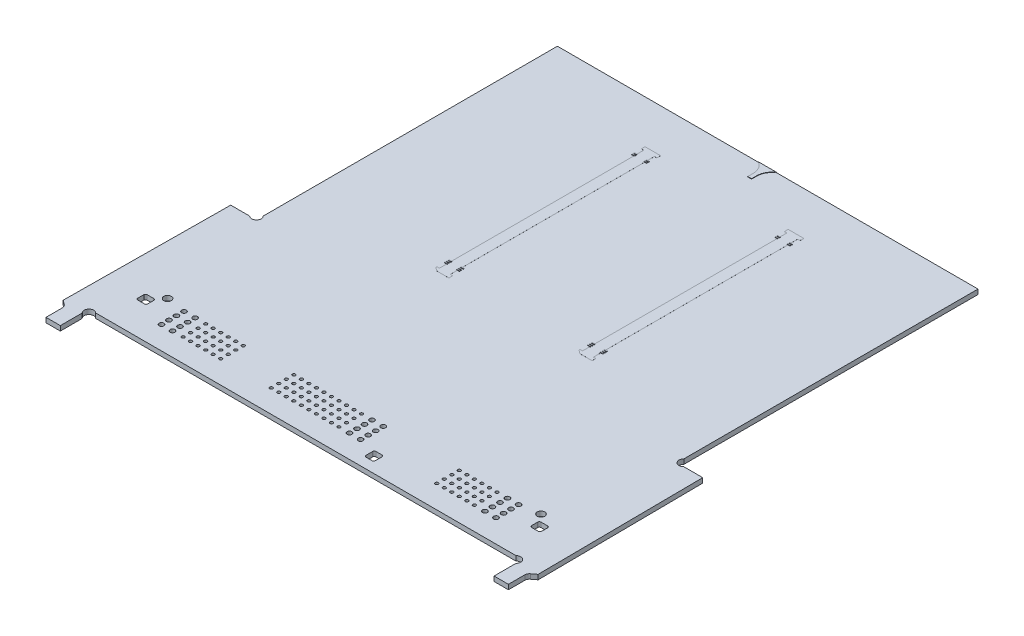
from build123d import *

# Parameters (mm, degrees)
SKETCH4_R      = 1.254
SKETCH4_R_2    = 0.79375
SKETCH4_R_3    = 0.508
SKETCH4_R_4    = 0.3762
SKETCH4_R_5    = 0.4762
EXTRUDE3_DEPTH = 0.79375
EXTRUDE5_DEPTH = 0.0127
SKETCH5_W      = 0.92
SKETCH5_H      = 0.27
EXTRUDE4_DEPTH = 0.127


with BuildPart() as part:
    # Sketch4 → Extrude3 (new, symmetric)
    with BuildSketch(Plane(origin=(0, 0, 0), x_dir=(1, 0, 0), z_dir=(0, 1, 0))):
        with BuildLine():
            Line((69.8881, 132.04590549), (2.975548534, 132.04590549))
            Line((2.975548534, 132.04590549), (-2.975548534, 132.04590549))
            Line((-2.975548534, 132.04590549), (-69.8881, 132.04590549))
            Line((-69.8881, 132.04590549), (-69.8881, 34.269186558))
            ThreePointArc((-69.8881, 34.269186558), (-69.8881, 32.024122527), (-72.13316403, 32.024122527))
            Line((-72.13316403, 32.024122527), (-78.429293154, 32.024122527))
            Line((-78.429293154, 32.024122527), (-78.910794169, -23.152529514))
            Line((-78.910794169, -23.152529514), (-77.458445681, -24.262651291))
            ThreePointArc((-77.458445681, -24.262651291), (-76.999370968, -24.82043999), (-76.835, -25.52390286))
            Line((-76.835, -25.52390286), (-76.835, -30.960744262))
            Line((-76.835, -30.960744262), (-72.070498153, -30.960744262))
            Line((-72.070498153, -30.960744262), (-72.070498153, -23.691557319))
            ThreePointArc((-72.070498153, -23.691557319), (-72.070498153, -21.446493288), (-69.825434123, -21.446493288))
            Line((-69.825434123, -21.446493288), (69.825434123, -21.446493288))
            ThreePointArc((69.825434123, -21.446493288), (72.070498153, -21.446493288), (72.070498153, -23.691557319))
            Line((72.070498153, -23.691557319), (72.070498153, -30.960744262))
            Line((72.070498153, -30.960744262), (76.835, -30.960744262))
            Line((76.835, -30.960744262), (76.835, -25.52390286))
            ThreePointArc((76.835, -25.52390286), (76.999370968, -24.82043999), (77.458445681, -24.262651291))
            Line((77.458445681, -24.262651291), (78.910794169, -23.152529514))
            Line((78.910794169, -23.152529514), (78.429293154, 32.024122527))
            Line((78.429293154, 32.024122527), (72.13316403, 32.024122527))
            ThreePointArc((72.13316403, 32.024122527), (69.8881, 32.024122527), (69.8881, 34.269186558))
            Line((69.8881, 34.269186558), (69.8881, 132.04590549))
        make_face()
        with Locations((62.05, -5.34148242)):
            Circle(SKETCH4_R, mode=Mode.SUBTRACT)
        with Locations((-62.05, -5.34148242)):
            Circle(SKETCH4_R, mode=Mode.SUBTRACT)
        with Locations((51.9, -6.33898242)):
            Circle(SKETCH4_R_2, mode=Mode.SUBTRACT)
        with Locations((3.4, -6.33898242)):
            Circle(SKETCH4_R_3, mode=Mode.SUBTRACT)
        with Locations((6.9, -6.33898242)):
            Circle(SKETCH4_R_2, mode=Mode.SUBTRACT)
        with Locations((55.6, -6.33898242)):
            Circle(SKETCH4_R_2, mode=Mode.SUBTRACT)
        with Locations((10.6, -6.33898242)):
            Circle(SKETCH4_R_2, mode=Mode.SUBTRACT)
        with Locations((-55.6, -6.33898242)):
            Circle(SKETCH4_R_2, mode=Mode.SUBTRACT)
        with Locations((-48.4, -6.33898242)):
            Circle(SKETCH4_R_3, mode=Mode.SUBTRACT)
        with Locations((-55.6, -11.33898242)):
            Circle(SKETCH4_R_2, mode=Mode.SUBTRACT)
        with Locations((-51.9, -8.83898242)):
            Circle(SKETCH4_R_2, mode=Mode.SUBTRACT)
        with Locations((-55.6, -8.83898242)):
            Circle(SKETCH4_R_2, mode=Mode.SUBTRACT)
        with Locations((-51.9, -6.33898242)):
            Circle(SKETCH4_R_2, mode=Mode.SUBTRACT)
        with Locations((51.9, -8.83898242)):
            Circle(SKETCH4_R_2, mode=Mode.SUBTRACT)
        with Locations((6.9, -8.83898242)):
            Circle(SKETCH4_R_2, mode=Mode.SUBTRACT)
        with Locations((55.6, -8.83898242)):
            Circle(SKETCH4_R_2, mode=Mode.SUBTRACT)
        with Locations((10.6, -8.83898242)):
            Circle(SKETCH4_R_2, mode=Mode.SUBTRACT)
        with Locations((10.6, -13.83898242)):
            Circle(SKETCH4_R_2, mode=Mode.SUBTRACT)
        with Locations((51.9, -11.33898242)):
            Circle(SKETCH4_R_2, mode=Mode.SUBTRACT)
        with Locations((6.9, -11.33898242)):
            Circle(SKETCH4_R_2, mode=Mode.SUBTRACT)
        with Locations((55.6, -11.33898242)):
            Circle(SKETCH4_R_2, mode=Mode.SUBTRACT)
        with Locations((10.6, -11.33898242)):
            Circle(SKETCH4_R_2, mode=Mode.SUBTRACT)
        with Locations((-51.9, -13.83898242)):
            Circle(SKETCH4_R_2, mode=Mode.SUBTRACT)
        with Locations((-55.6, -13.83898242)):
            Circle(SKETCH4_R_2, mode=Mode.SUBTRACT)
        with Locations((-51.9, -11.33898242)):
            Circle(SKETCH4_R_2, mode=Mode.SUBTRACT)
        with Locations((-35.9, -6.33898242)):
            Circle(SKETCH4_R_3, mode=Mode.SUBTRACT)
        with Locations((-38.4, -6.33898242)):
            Circle(SKETCH4_R_3, mode=Mode.SUBTRACT)
        with Locations((-40.9, -6.33898242)):
            Circle(SKETCH4_R_3, mode=Mode.SUBTRACT)
        with Locations((-43.4, -6.33898242)):
            Circle(SKETCH4_R_3, mode=Mode.SUBTRACT)
        with Locations((-45.9, -6.33898242)):
            Circle(SKETCH4_R_3, mode=Mode.SUBTRACT)
        with Locations((6.9, -13.83898242)):
            Circle(SKETCH4_R_2, mode=Mode.SUBTRACT)
        with Locations((48.4, -6.33898242)):
            Circle(SKETCH4_R_3, mode=Mode.SUBTRACT)
        with Locations((55.6, -13.83898242)):
            Circle(SKETCH4_R_2, mode=Mode.SUBTRACT)
        with Locations((-45.9, -11.33898242)):
            Circle(SKETCH4_R_3, mode=Mode.SUBTRACT)
        with Locations((-48.4, -11.33898242)):
            Circle(SKETCH4_R_3, mode=Mode.SUBTRACT)
        with Locations((-35.9, -8.83898242)):
            Circle(SKETCH4_R_3, mode=Mode.SUBTRACT)
        with Locations((-38.4, -8.83898242)):
            Circle(SKETCH4_R_3, mode=Mode.SUBTRACT)
        with Locations((-40.9, -8.83898242)):
            Circle(SKETCH4_R_3, mode=Mode.SUBTRACT)
        with Locations((-43.4, -8.83898242)):
            Circle(SKETCH4_R_3, mode=Mode.SUBTRACT)
        with Locations((-45.9, -8.83898242)):
            Circle(SKETCH4_R_3, mode=Mode.SUBTRACT)
        with Locations((-48.4, -8.83898242)):
            Circle(SKETCH4_R_3, mode=Mode.SUBTRACT)
        with Locations((-40.9, -13.83898242)):
            Circle(SKETCH4_R_3, mode=Mode.SUBTRACT)
        with Locations((-43.4, -13.83898242)):
            Circle(SKETCH4_R_3, mode=Mode.SUBTRACT)
        with Locations((-45.9, -13.83898242)):
            Circle(SKETCH4_R_3, mode=Mode.SUBTRACT)
        with Locations((-48.4, -13.83898242)):
            Circle(SKETCH4_R_3, mode=Mode.SUBTRACT)
        with Locations((-35.9, -11.33898242)):
            Circle(SKETCH4_R_3, mode=Mode.SUBTRACT)
        with Locations((-38.4, -11.33898242)):
            Circle(SKETCH4_R_3, mode=Mode.SUBTRACT)
        with Locations((-40.9, -11.33898242)):
            Circle(SKETCH4_R_3, mode=Mode.SUBTRACT)
        with Locations((-43.4, -11.33898242)):
            Circle(SKETCH4_R_3, mode=Mode.SUBTRACT)
        with Locations((35.9, -6.33898242)):
            Circle(SKETCH4_R_3, mode=Mode.SUBTRACT)
        with Locations((38.4, -6.33898242)):
            Circle(SKETCH4_R_3, mode=Mode.SUBTRACT)
        with Locations((40.9, -6.33898242)):
            Circle(SKETCH4_R_3, mode=Mode.SUBTRACT)
        with Locations((43.4, -6.33898242)):
            Circle(SKETCH4_R_3, mode=Mode.SUBTRACT)
        with Locations((45.9, -6.33898242)):
            Circle(SKETCH4_R_3, mode=Mode.SUBTRACT)
        with Locations((51.9, -13.83898242)):
            Circle(SKETCH4_R_2, mode=Mode.SUBTRACT)
        with Locations((-35.9, -13.83898242)):
            Circle(SKETCH4_R_3, mode=Mode.SUBTRACT)
        with Locations((-38.4, -13.83898242)):
            Circle(SKETCH4_R_3, mode=Mode.SUBTRACT)
        with Locations((45.9, -11.33898242)):
            Circle(SKETCH4_R_3, mode=Mode.SUBTRACT)
        with Locations((48.4, -11.33898242)):
            Circle(SKETCH4_R_3, mode=Mode.SUBTRACT)
        with Locations((35.9, -8.83898242)):
            Circle(SKETCH4_R_3, mode=Mode.SUBTRACT)
        with Locations((38.4, -8.83898242)):
            Circle(SKETCH4_R_3, mode=Mode.SUBTRACT)
        with Locations((40.9, -8.83898242)):
            Circle(SKETCH4_R_3, mode=Mode.SUBTRACT)
        with Locations((43.4, -8.83898242)):
            Circle(SKETCH4_R_3, mode=Mode.SUBTRACT)
        with Locations((45.9, -8.83898242)):
            Circle(SKETCH4_R_3, mode=Mode.SUBTRACT)
        with Locations((48.4, -8.83898242)):
            Circle(SKETCH4_R_3, mode=Mode.SUBTRACT)
        with Locations((40.9, -13.83898242)):
            Circle(SKETCH4_R_3, mode=Mode.SUBTRACT)
        with Locations((43.4, -13.83898242)):
            Circle(SKETCH4_R_3, mode=Mode.SUBTRACT)
        with Locations((45.9, -13.83898242)):
            Circle(SKETCH4_R_3, mode=Mode.SUBTRACT)
        with Locations((48.4, -13.83898242)):
            Circle(SKETCH4_R_3, mode=Mode.SUBTRACT)
        with Locations((35.9, -11.33898242)):
            Circle(SKETCH4_R_3, mode=Mode.SUBTRACT)
        with Locations((38.4, -11.33898242)):
            Circle(SKETCH4_R_3, mode=Mode.SUBTRACT)
        with Locations((40.9, -11.33898242)):
            Circle(SKETCH4_R_3, mode=Mode.SUBTRACT)
        with Locations((43.4, -11.33898242)):
            Circle(SKETCH4_R_3, mode=Mode.SUBTRACT)
        with Locations((-11.6, -6.33898242)):
            Circle(SKETCH4_R_3, mode=Mode.SUBTRACT)
        with Locations((-9.1, -6.33898242)):
            Circle(SKETCH4_R_3, mode=Mode.SUBTRACT)
        with Locations((-6.6, -6.33898242)):
            Circle(SKETCH4_R_3, mode=Mode.SUBTRACT)
        with Locations((-4.1, -6.33898242)):
            Circle(SKETCH4_R_3, mode=Mode.SUBTRACT)
        with Locations((-1.6, -6.33898242)):
            Circle(SKETCH4_R_3, mode=Mode.SUBTRACT)
        with Locations((0.9, -6.33898242)):
            Circle(SKETCH4_R_3, mode=Mode.SUBTRACT)
        with Locations((35.9, -13.83898242)):
            Circle(SKETCH4_R_3, mode=Mode.SUBTRACT)
        with Locations((38.4, -13.83898242)):
            Circle(SKETCH4_R_3, mode=Mode.SUBTRACT)
        with Locations((-6.6, -8.83898242)):
            Circle(SKETCH4_R_3, mode=Mode.SUBTRACT)
        with Locations((-4.1, -8.83898242)):
            Circle(SKETCH4_R_3, mode=Mode.SUBTRACT)
        with Locations((-1.6, -8.83898242)):
            Circle(SKETCH4_R_3, mode=Mode.SUBTRACT)
        with Locations((0.9, -8.83898242)):
            Circle(SKETCH4_R_3, mode=Mode.SUBTRACT)
        with Locations((3.4, -8.83898242)):
            Circle(SKETCH4_R_3, mode=Mode.SUBTRACT)
        with Locations((-19.1, -6.33898242)):
            Circle(SKETCH4_R_3, mode=Mode.SUBTRACT)
        with Locations((-16.6, -6.33898242)):
            Circle(SKETCH4_R_3, mode=Mode.SUBTRACT)
        with Locations((-14.1, -6.33898242)):
            Circle(SKETCH4_R_3, mode=Mode.SUBTRACT)
        with Locations((-1.6, -11.33898242)):
            Circle(SKETCH4_R_3, mode=Mode.SUBTRACT)
        with Locations((0.9, -11.33898242)):
            Circle(SKETCH4_R_3, mode=Mode.SUBTRACT)
        with Locations((3.4, -11.33898242)):
            Circle(SKETCH4_R_3, mode=Mode.SUBTRACT)
        with Locations((-19.1, -8.83898242)):
            Circle(SKETCH4_R_3, mode=Mode.SUBTRACT)
        with Locations((-16.6, -8.83898242)):
            Circle(SKETCH4_R_3, mode=Mode.SUBTRACT)
        with Locations((-14.1, -8.83898242)):
            Circle(SKETCH4_R_3, mode=Mode.SUBTRACT)
        with Locations((-11.6, -8.83898242)):
            Circle(SKETCH4_R_3, mode=Mode.SUBTRACT)
        with Locations((-9.1, -8.83898242)):
            Circle(SKETCH4_R_3, mode=Mode.SUBTRACT)
        with Locations((3.4, -13.83898242)):
            Circle(SKETCH4_R_3, mode=Mode.SUBTRACT)
        with Locations((-19.1, -11.33898242)):
            Circle(SKETCH4_R_3, mode=Mode.SUBTRACT)
        with Locations((-16.6, -11.33898242)):
            Circle(SKETCH4_R_3, mode=Mode.SUBTRACT)
        with Locations((-14.1, -11.33898242)):
            Circle(SKETCH4_R_3, mode=Mode.SUBTRACT)
        with Locations((-11.6, -11.33898242)):
            Circle(SKETCH4_R_3, mode=Mode.SUBTRACT)
        with Locations((-9.1, -11.33898242)):
            Circle(SKETCH4_R_3, mode=Mode.SUBTRACT)
        with Locations((-6.6, -11.33898242)):
            Circle(SKETCH4_R_3, mode=Mode.SUBTRACT)
        with Locations((-4.1, -11.33898242)):
            Circle(SKETCH4_R_3, mode=Mode.SUBTRACT)
        with Locations((-16.6, -13.83898242)):
            Circle(SKETCH4_R_3, mode=Mode.SUBTRACT)
        with Locations((-14.1, -13.83898242)):
            Circle(SKETCH4_R_3, mode=Mode.SUBTRACT)
        with Locations((-11.6, -13.83898242)):
            Circle(SKETCH4_R_3, mode=Mode.SUBTRACT)
        with Locations((-9.1, -13.83898242)):
            Circle(SKETCH4_R_3, mode=Mode.SUBTRACT)
        with Locations((-6.6, -13.83898242)):
            Circle(SKETCH4_R_3, mode=Mode.SUBTRACT)
        with Locations((-4.1, -13.83898242)):
            Circle(SKETCH4_R_3, mode=Mode.SUBTRACT)
        with Locations((-1.6, -13.83898242)):
            Circle(SKETCH4_R_3, mode=Mode.SUBTRACT)
        with Locations((0.9, -13.83898242)):
            Circle(SKETCH4_R_3, mode=Mode.SUBTRACT)
        with Locations((-19.1, -13.83898242)):
            Circle(SKETCH4_R_3, mode=Mode.SUBTRACT)
        with Locations((-23.8, 115.169684623)):
            Circle(SKETCH4_R_4, mode=Mode.SUBTRACT)
        with Locations((-23.8, 49.799684623)):
            Circle(SKETCH4_R_5, mode=Mode.SUBTRACT)
        with Locations((23.8, 49.799684623)):
            Circle(SKETCH4_R_5, mode=Mode.SUBTRACT)
        with Locations((23.8, 115.169684623)):
            Circle(SKETCH4_R_4, mode=Mode.SUBTRACT)
        with BuildLine():
            Line((-66.55, -10.74548242), (-64.35, -10.74548242))
            ThreePointArc((-64.35, -10.74548242), (-63.958262843, -10.583219577), (-63.796, -10.19148242))
            Line((-63.796, -10.19148242), (-63.796, -8.19148242))
            ThreePointArc((-63.796, -8.19148242), (-63.958262843, -7.799745263), (-64.35, -7.63748242))
            Line((-64.35, -7.63748242), (-66.55, -7.63748242))
            ThreePointArc((-66.55, -7.63748242), (-66.941737157, -7.799745263), (-67.104, -8.19148242))
            Line((-67.104, -8.19148242), (-67.104, -10.19148242))
            ThreePointArc((-67.104, -10.19148242), (-66.941737157, -10.583219577), (-66.55, -10.74548242))
        make_face(mode=Mode.SUBTRACT)
        with BuildLine():
            Line((16.6, -18.04548242), (18.6, -18.04548242))
            ThreePointArc((18.6, -18.04548242), (18.991737157, -17.883219577), (19.154, -17.49148242))
            Line((19.154, -17.49148242), (19.154, -15.29148242))
            ThreePointArc((19.154, -15.29148242), (18.991737157, -14.899745263), (18.6, -14.73748242))
            Line((18.6, -14.73748242), (16.6, -14.73748242))
            ThreePointArc((16.6, -14.73748242), (16.208262843, -14.899745263), (16.046, -15.29148242))
            Line((16.046, -15.29148242), (16.046, -17.49148242))
            ThreePointArc((16.046, -17.49148242), (16.208262843, -17.883219577), (16.6, -18.04548242))
        make_face(mode=Mode.SUBTRACT)
        with BuildLine():
            Line((64.35, -10.74548242), (66.55, -10.74548242))
            ThreePointArc((66.55, -10.74548242), (66.941737157, -10.583219577), (67.104, -10.19148242))
            Line((67.104, -10.19148242), (67.104, -8.19148242))
            ThreePointArc((67.104, -8.19148242), (66.941737157, -7.799745263), (66.55, -7.63748242))
            Line((66.55, -7.63748242), (64.35, -7.63748242))
            ThreePointArc((64.35, -7.63748242), (63.958262843, -7.799745263), (63.796, -8.19148242))
            Line((63.796, -8.19148242), (63.796, -10.19148242))
            ThreePointArc((63.796, -10.19148242), (63.958262843, -10.583219577), (64.35, -10.74548242))
        make_face(mode=Mode.SUBTRACT)
    extrude(amount=EXTRUDE3_DEPTH, both=True)

    # Sketch6 → Extrude5 (add)
    with BuildSketch(Plane(origin=(0, 0.79375, 0), x_dir=(1, 0, 0), z_dir=(0, 1, 0))):
        Polygon((26.4, 117.654521691), (21.2, 117.654521691), (21.2, 116.404521691), (22.01, 116.404521691), (22.01, 48.534521691), (21.2, 48.534521691), (21.2, 48.124770737), (22.4, 47.284521691), (26.4, 47.284521691), (26.4, 48.534521691), (25.59, 48.534521691), (25.59, 116.404521691), (26.4, 116.404521691), align=None)
        Polygon((-21.2, 47.299684623), (-21.2, 48.549684623), (-22.01, 48.549684623), (-22.01, 116.419684623), (-21.2, 116.419684623), (-21.2, 117.669684623), (-26.4, 117.669684623), (-26.4, 116.419684623), (-25.59, 116.419684623), (-25.59, 48.549684623), (-26.4, 48.549684623), (-26.4, 48.139933669), (-25.2, 47.299684623), align=None)
    extrude(amount=EXTRUDE5_DEPTH)

    # Sketch5 → Extrude4 (add)
    with BuildSketch(Plane(origin=(0, 0.79375, 0), x_dir=(1, 0, 0), z_dir=(0, 1, 0))):
        with BuildLine():
            Line((0.635, 126.049743895), (0.635, 127.767681619))
            ThreePointArc((0.635, 127.767681619), (1.258375649, 130.205993128), (2.975548534, 132.04590549))
            Line((2.975548534, 132.04590549), (-2.975548534, 132.04590549))
            ThreePointArc((-2.975548534, 132.04590549), (-1.258376818, 130.205992489), (-0.635, 127.767681619))
            Line((-0.635, 127.767681619), (-0.635, 126.049743895))
            Line((-0.635, 126.049743895), (0.635, 126.049743895))
        make_face()
        with Locations((-25.84, 113.917184623)):
            Rectangle(SKETCH5_W, SKETCH5_H)
        with Locations((-25.84, 113.282184623)):
            Rectangle(SKETCH5_W, SKETCH5_H)
        with Locations((25.84, 113.917184623)):
            Rectangle(SKETCH5_W, SKETCH5_H)
        with Locations((25.84, 113.282184623)):
            Rectangle(SKETCH5_W, SKETCH5_H)
        with Locations((21.76, 113.917184623)):
            Rectangle(SKETCH5_W, SKETCH5_H)
        with Locations((21.76, 113.282184623)):
            Rectangle(SKETCH5_W, SKETCH5_H)
        with Locations((-21.76, 113.282184623)):
            Rectangle(SKETCH5_W, SKETCH5_H)
        with Locations((-21.76, 113.917184623)):
            Rectangle(SKETCH5_W, SKETCH5_H)
        with Locations((25.84, 51.052184623)):
            Rectangle(SKETCH5_W, SKETCH5_H)
        with Locations((25.84, 51.687184623)):
            Rectangle(SKETCH5_W, SKETCH5_H)
        with Locations((25.84, 52.322184623)):
            Rectangle(SKETCH5_W, SKETCH5_H)
        with Locations((21.76, 52.322184623)):
            Rectangle(SKETCH5_W, SKETCH5_H)
        with Locations((21.76, 51.687184623)):
            Rectangle(SKETCH5_W, SKETCH5_H)
        with Locations((21.76, 51.052184623)):
            Rectangle(SKETCH5_W, SKETCH5_H)
        with Locations((-21.76, 51.052184623)):
            Rectangle(SKETCH5_W, SKETCH5_H)
        with Locations((-21.76, 51.687184623)):
            Rectangle(SKETCH5_W, SKETCH5_H)
        with Locations((-21.76, 52.322184623)):
            Rectangle(SKETCH5_W, SKETCH5_H)
        with Locations((-25.84, 52.322184623)):
            Rectangle(SKETCH5_W, SKETCH5_H)
        with Locations((-25.84, 51.687184623)):
            Rectangle(SKETCH5_W, SKETCH5_H)
        with Locations((-25.84, 51.052184623)):
            Rectangle(SKETCH5_W, SKETCH5_H)
    extrude(amount=EXTRUDE4_DEPTH)


solid = part.part
